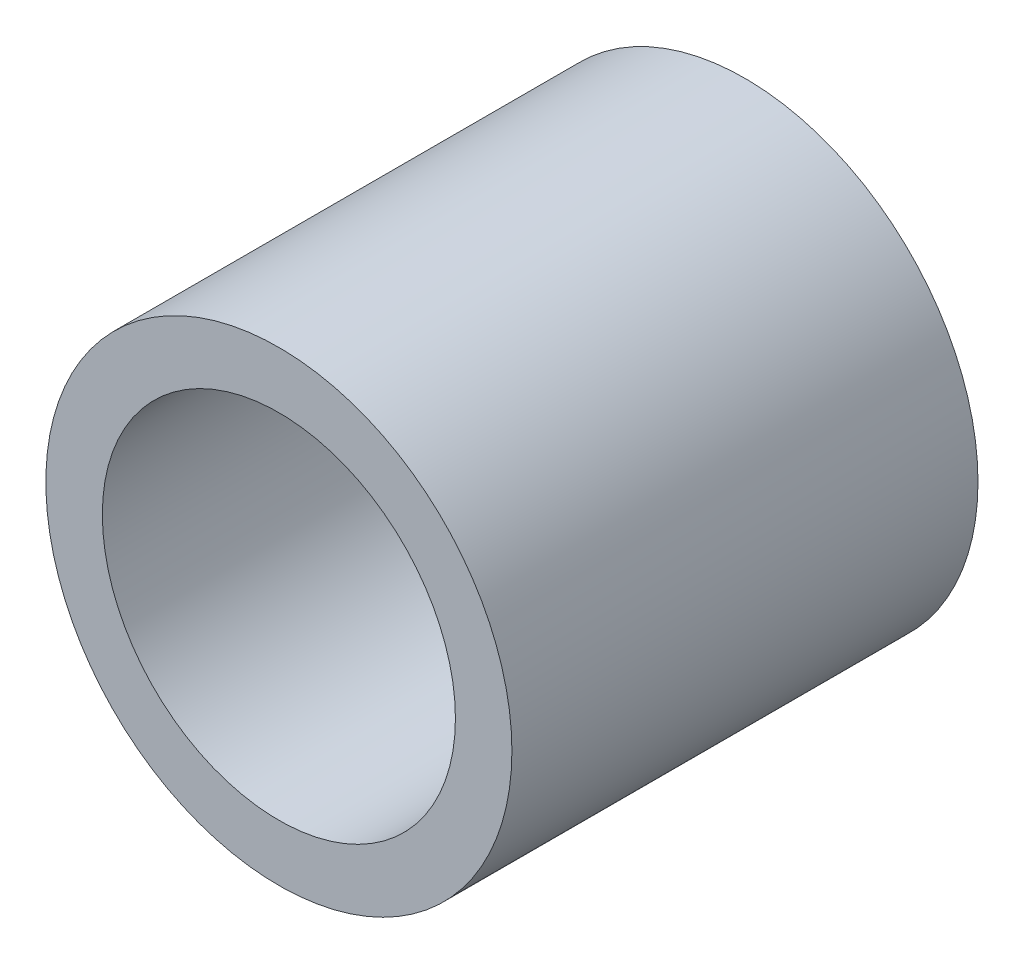
from build123d import *

# Parameters (mm, degrees)
ESBO_O1_R                = 8.25
ESBO_O1_R_2              = 6.25
RESSALTO_EXTRUS_O1_DEPTH = 16.5


with BuildPart() as part:
    # Esboço1 → Ressalto-extrusão1 (new body)
    with BuildSketch(Plane.XY):
        Circle(ESBO_O1_R)
        Circle(ESBO_O1_R_2, mode=Mode.SUBTRACT)
    extrude(amount=RESSALTO_EXTRUS_O1_DEPTH)


solid = part.part
